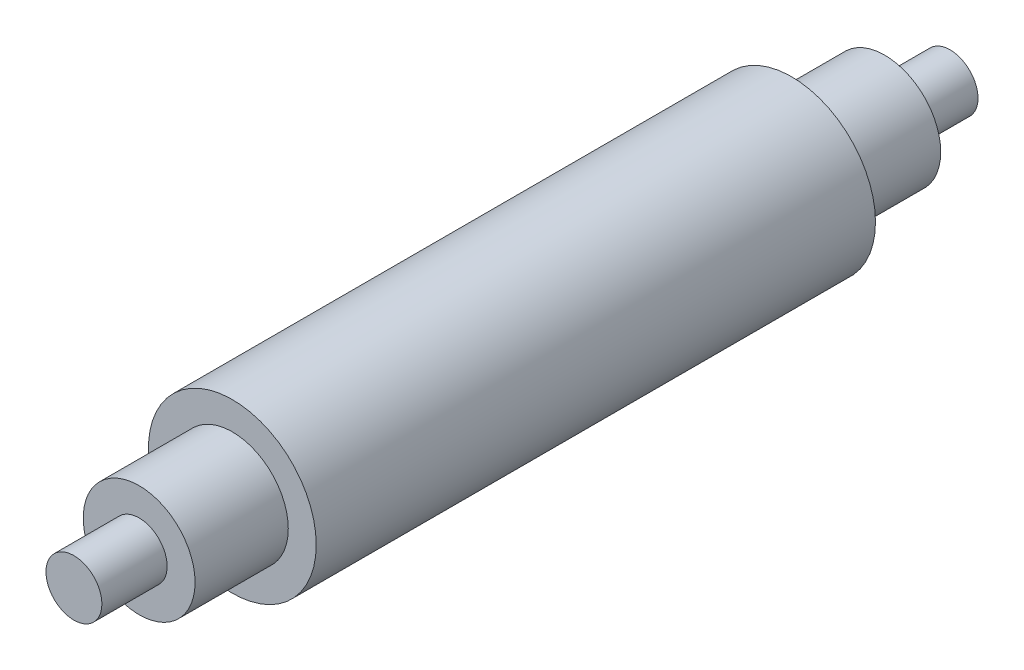
from build123d import *

# Parameters (mm, degrees)
SKETCH1_R           = 45
BOSS_EXTRUDE1_DEPTH = 150
SKETCH2_R           = 30
BOSS_EXTRUDE2_DEPTH = 50
SKETCH3_R           = 15
BOSS_EXTRUDE3_DEPTH = 35


with BuildPart() as part:
    # Sketch1 → Boss-Extrude1 (new, symmetric)
    with BuildSketch(Plane.XY):
        Circle(SKETCH1_R)
    extrude(amount=BOSS_EXTRUDE1_DEPTH, both=True)

    # Sketch2 → Boss-Extrude2 (add)
    with BuildSketch(Plane.XY.offset(150)):
        Circle(SKETCH2_R)
    boss_extrude2 = extrude(amount=BOSS_EXTRUDE2_DEPTH)

    # Sketch3 → Boss-Extrude3 (add)
    with BuildSketch(Plane.XY.offset(200)):
        Circle(SKETCH3_R)
    boss_extrude3 = extrude(amount=BOSS_EXTRUDE3_DEPTH)

    # Mirror2: Boss-Extrude2, Boss-Extrude3 across plane
    add(boss_extrude2.mirror(Plane.XY))
    add(boss_extrude3.mirror(Plane.XY))


solid = part.part
